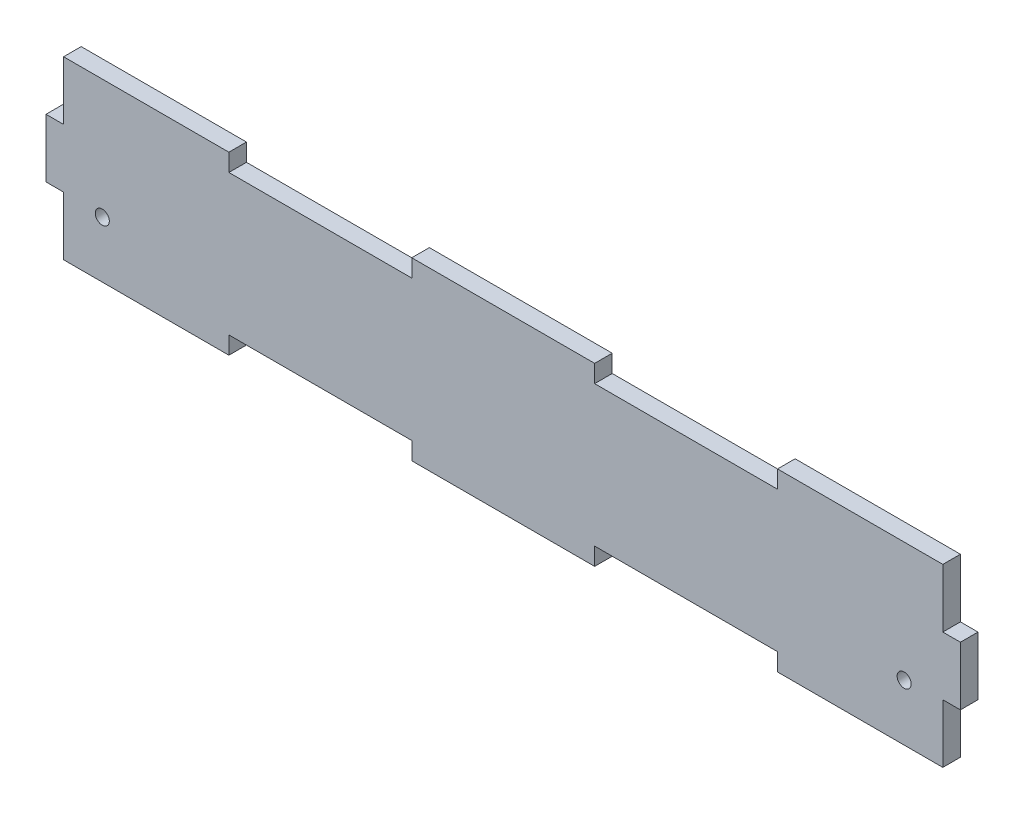
from build123d import *

# Parameters (mm, degrees)
CROQUIS1_R              = 2
SALIENTE_EXTRUIR1_DEPTH = 5


with BuildPart() as part:
    # Croquis1 → Saliente-Extruir1 (new body)
    with BuildSketch(Plane.XY):
        Polygon((0, 33.333333333), (5, 33.333333333), (5, 50), (52, 50), (52, 45), (104, 45), (104, 50), (156, 50), (156, 45), (208, 45), (208, 50), (255, 50), (255, 33.333333333), (260, 33.333333333), (260, 16.666666667), (255, 16.666666667), (255, 0), (208, 0), (208, 5), (156, 5), (156, 0), (104, 0), (104, 5), (52, 5), (52, 0), (5, 0), (5, 16.666666667), (0, 16.666666667), align=None)
        with Locations((16, 16)):
            Circle(CROQUIS1_R, mode=Mode.SUBTRACT)
        with Locations(Location((244, 16, 0), (0, 0, 180))):
            Circle(CROQUIS1_R, mode=Mode.SUBTRACT)
    extrude(amount=SALIENTE_EXTRUIR1_DEPTH)


solid = part.part
